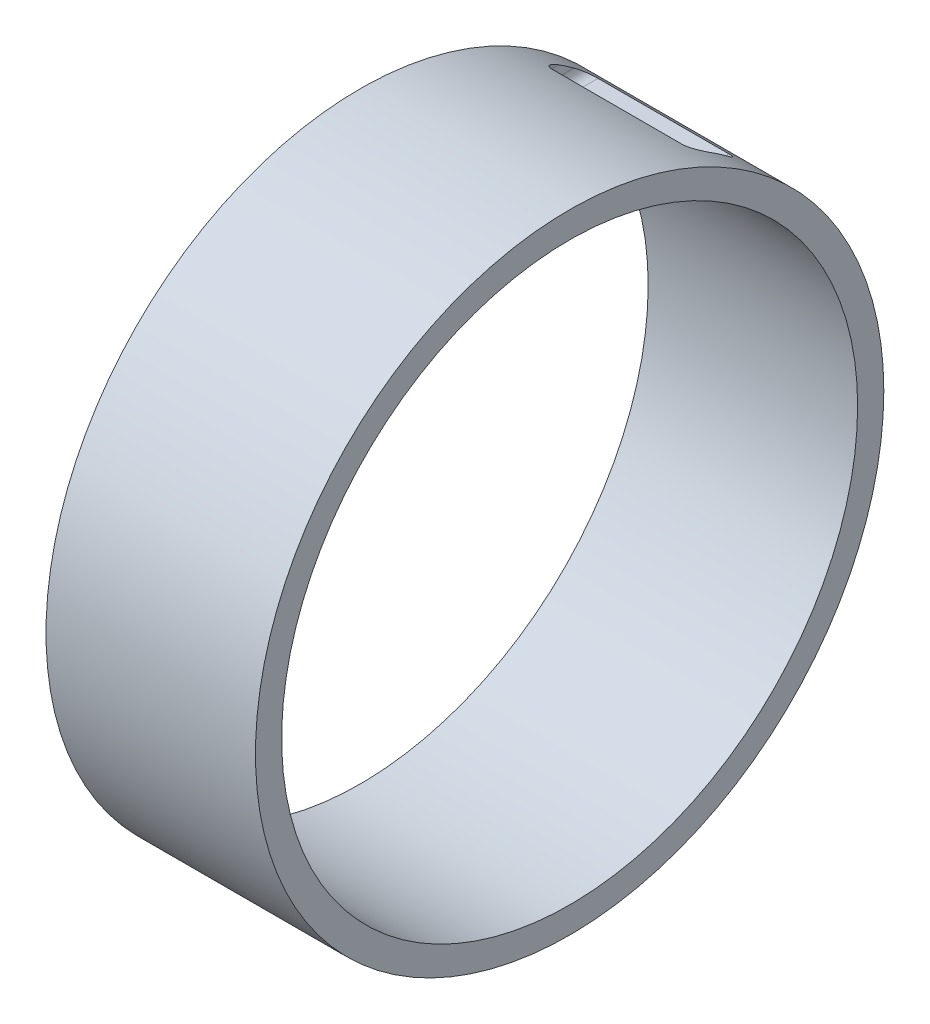
from build123d import *

# Parameters (mm, degrees)
SKETCH1_R               = 76.2
SKETCH1_R_2             = 69.85
BOSS_EXTRUDE1_DEPTH     = 25.4
CUT_EXTRUDE1_REACH      = 112.716
CUT_EXTRUDE1_END_RADIUS = 76.2
SKETCH4_W               = 36.83
SKETCH4_H               = 7.62
FILLET1_R               = 2.54


with BuildPart() as part:
    # Sketch1 → Boss-Extrude1 (new, symmetric)
    with BuildSketch(Plane(origin=(0, 0, 0), x_dir=(0, 0, -1), z_dir=(1, 0, 0))):
        Circle(SKETCH1_R)
        Circle(SKETCH1_R_2, mode=Mode.SUBTRACT)
    extrude(amount=BOSS_EXTRUDE1_DEPTH, both=True)

    # Cut-Extrude1: up to this cylinder (the profile starts inside it)
    cut_extrude1_end = Plane(origin=(0, 0, 0), z_dir=(-1, 0, 0)) * Cylinder(CUT_EXTRUDE1_END_RADIUS, 378.832, mode=Mode.PRIVATE)
    # Sketch4 → Cut-Extrude1 (cut, up to the surface)
    with BuildSketch(Plane.XY, mode=Mode.PRIVATE) as cut_extrude1_sk1:
        with Locations((0, 62.865)):
            Rectangle(SKETCH4_W, SKETCH4_H)
    cut_extrude1_tool1 = extrude(cut_extrude1_sk1.sketch, amount=-CUT_EXTRUDE1_REACH, mode=Mode.PRIVATE) & cut_extrude1_end
    add(cut_extrude1_tool1.solids().sort_by_distance((0, 62.865, 0))[0], mode=Mode.SUBTRACT)

    # Fillet1
    fillet1_edges = [part.edges().sort_by_distance(p)[0] for p in [
        (-18.415, 59.055, -42.729327968),
        (-18.415, 66.675, -28.855016844),
        (18.415, 66.675, -28.855016844),
        (18.415, 59.055, -42.729327968),
    ]]
    fillet(fillet1_edges, radius=FILLET1_R)


solid = part.part
